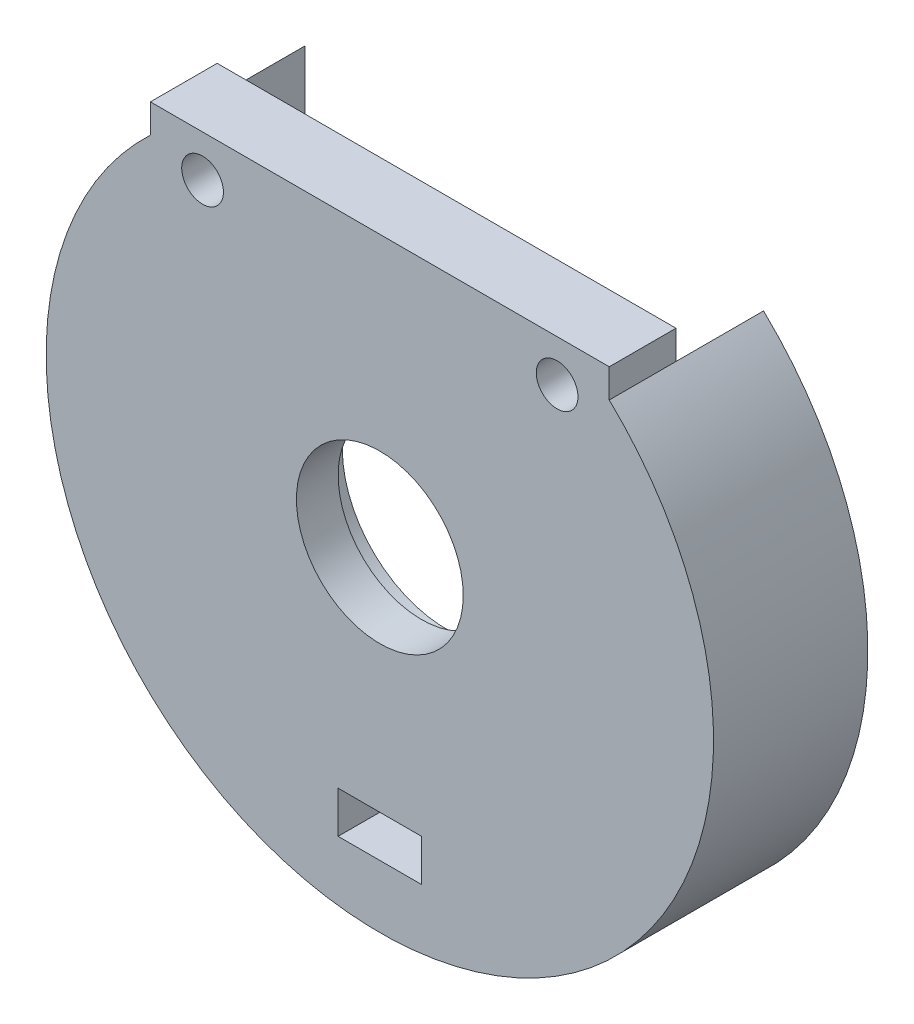
from build123d import *

# Parameters (mm, degrees)
BOSS_EXTRUDE1_DEPTH = 1.4
BOSS_EXTRUDE2_DEPTH = 0.7
SKETCH3_R           = 0.5
SKETCH3_R_2         = 2.5
BOSS_EXTRUDE3_DEPTH = 0.6
SKETCH4_R           = 2
SKETCH4_R_2         = 0.5
SKETCH4_W           = 2
SKETCH4_H           = 1
BOSS_EXTRUDE4_DEPTH = 1


with BuildPart() as part:
    # Sketch1 → Boss-Extrude1 (new body)
    with BuildSketch(Plane.XY):
        with BuildLine():
            Line((-5.5, 5.809475019), (-5.5, -2.5))
            Line((-5.5, -2.5), (-2.5, -5.5))
            Line((-2.5, -5.5), (2.5, -5.5))
            Line((2.5, -5.5), (5.5, -2.5))
            Line((5.5, -2.5), (5.5, 5.809475019))
            ThreePointArc((5.5, 5.809475019), (0, -8), (-5.5, 5.809475019))
        make_face()
    extrude(amount=BOSS_EXTRUDE1_DEPTH)

    # Sketch2 → Boss-Extrude2 (add)
    with BuildSketch(Plane.XY.offset(1.4)):
        with BuildLine():
            Line((-1, -5.5), (-1, -6.5))
            Line((-1, -6.5), (1, -6.5))
            Line((1, -6.5), (1, -5.5))
            Line((1, -5.5), (2.5, -5.5))
            Line((2.5, -5.5), (5.5, -2.5))
            Line((5.5, -2.5), (5.5, 5.809475019))
            ThreePointArc((5.5, 5.809475019), (0, -8), (-5.5, 5.809475019))
            Line((-5.5, 5.809475019), (-5.5, -2.5))
            Line((-5.5, -2.5), (-2.5, -5.5))
            Line((-2.5, -5.5), (-1, -5.5))
        make_face()
    extrude(amount=BOSS_EXTRUDE2_DEPTH)

    # Sketch3 → Boss-Extrude3 (add)
    # profile 1 of 2: a face of its own
    with BuildSketch(Plane.XY.offset(2.1)):
        Polygon((2.5, -5.5), (5.5, -2.5), (5.5, 6.5), (-5.5, 6.5), (-5.5, -2.5), (-2.5, -5.5), align=None)
        with Locations((4.250000001, 5.5)):
            Circle(SKETCH3_R, mode=Mode.SUBTRACT)
        Circle(SKETCH3_R_2, mode=Mode.SUBTRACT)
        with Locations((-4.249999999, 5.5)):
            Circle(SKETCH3_R, mode=Mode.SUBTRACT)
    # profile 2 of 2: a face of its own
    with BuildSketch(Plane.XY.offset(2.1)):
        with BuildLine():
            Line((-1, -6.5), (-1, -5.5))
            Line((-1, -5.5), (-2.5, -5.5))
            Line((-2.5, -5.5), (-5.5, -2.5))
            Line((-5.5, -2.5), (-5.5, 5.809475019))
            ThreePointArc((-5.5, 5.809475019), (0, -8), (5.5, 5.809475019))
            Line((5.5, 5.809475019), (5.5, -2.5))
            Line((5.5, -2.5), (2.5, -5.5))
            Line((2.5, -5.5), (1, -5.5))
            Line((1, -5.5), (1, -6.5))
            Line((1, -6.5), (-1, -6.5))
        make_face()
    extrude(amount=BOSS_EXTRUDE3_DEPTH)

    # Sketch4 → Boss-Extrude4 (add)
    with BuildSketch(Plane.XY.offset(2.7)):
        with BuildLine():
            Line((-5.5, 5.809475019), (-5.5, 6.5))
            Line((-5.5, 6.5), (5.5, 6.5))
            Line((5.5, 6.5), (5.5, 5.809475019))
            ThreePointArc((5.5, 5.809475019), (0, -8), (-5.5, 5.809475019))
        make_face()
        Circle(SKETCH4_R, mode=Mode.SUBTRACT)
        with Locations((-4.249999999, 5.5)):
            Circle(SKETCH4_R_2, mode=Mode.SUBTRACT)
        with Locations((4.250000001, 5.5)):
            Circle(SKETCH4_R_2, mode=Mode.SUBTRACT)
        with Locations((0, -6)):
            Rectangle(SKETCH4_W, SKETCH4_H, mode=Mode.SUBTRACT)
    extrude(amount=BOSS_EXTRUDE4_DEPTH)


solid = part.part
